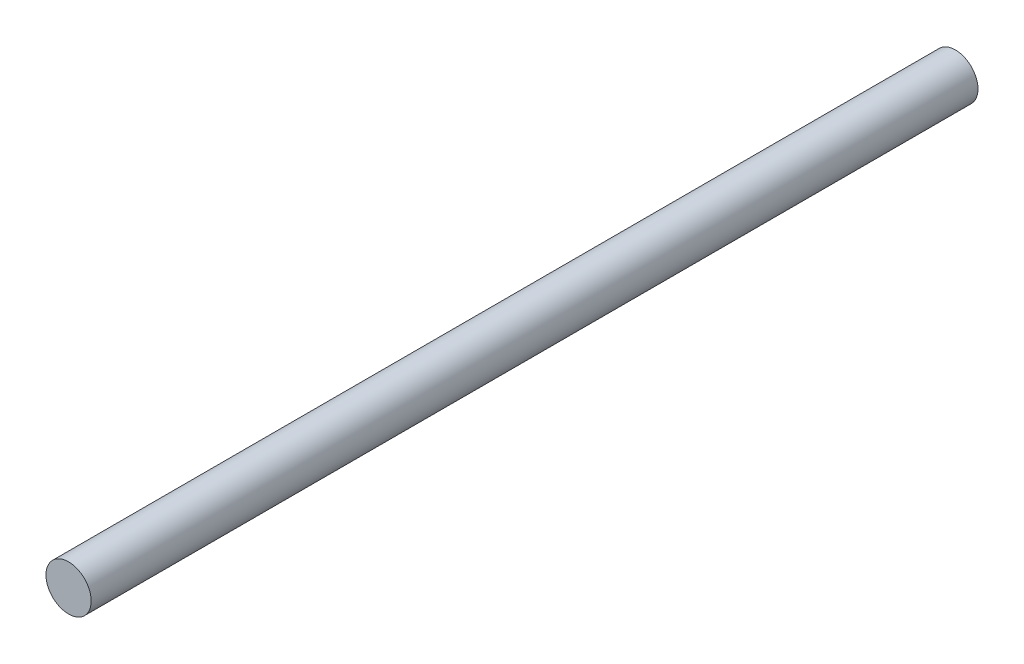
from build123d import *

# Parameters (mm, degrees)
SKETCH1_R           = 3.175
BOSS_EXTRUDE1_DEPTH = 124.46


with BuildPart() as part:
    # Sketch1 → Boss-Extrude1 (new body)
    with BuildSketch(Plane.XY):
        Circle(SKETCH1_R)
    extrude(amount=BOSS_EXTRUDE1_DEPTH)


solid = part.part
